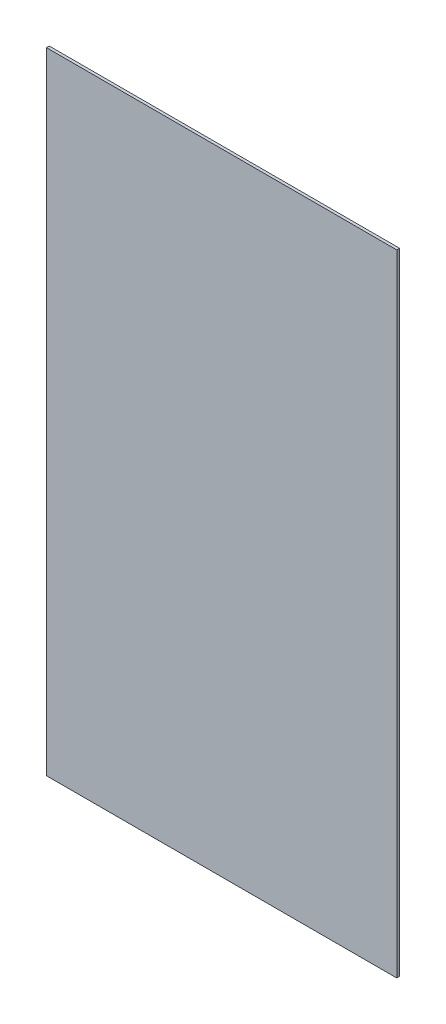
from build123d import *

# Parameters (mm, degrees)
SKETCH_1_W      = 25
SKETCH_1_H      = 45
EXTRUDE_1_DEPTH = 0.2


with BuildPart() as part:
    # 스케치1 → 보스-돌출1 (new body)
    with BuildSketch(Plane.XY):
        with Locations((12.5, 22.5)):
            Rectangle(SKETCH_1_W, SKETCH_1_H)
    extrude(amount=EXTRUDE_1_DEPTH)


solid = part.part
